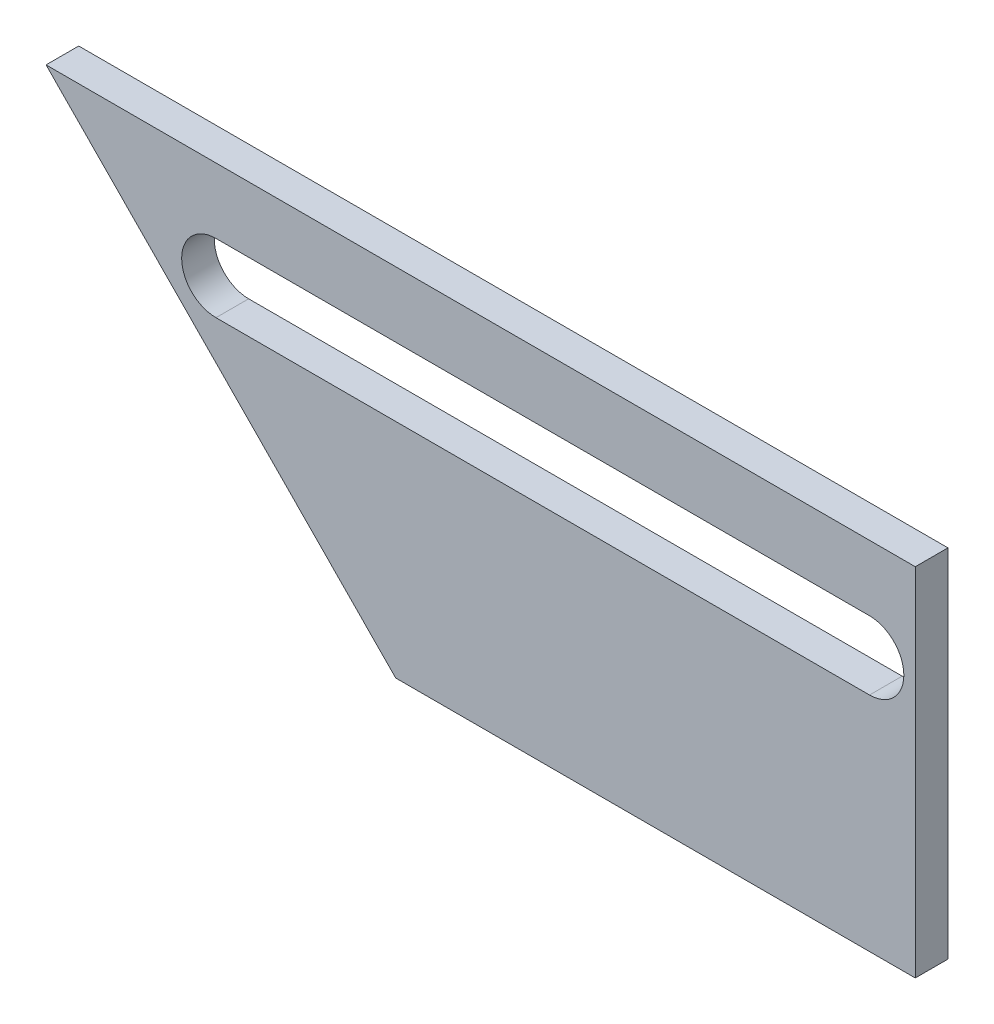
from build123d import *

# Parameters (mm, degrees)
BOSS_EXTRUDE1_DEPTH = 5


with BuildPart() as part:
    # Sketch1 → Boss-Extrude1 (new body)
    with BuildSketch(Plane.XY):
        Polygon((0, 0), (0, 54.5), (-133, 54.5), (-79.5, 0), align=None)
        with BuildLine():
            Line((-107, 44.5), (-7, 44.5))
            ThreePointArc((-7, 44.5), (-1.75, 39.25), (-7, 34))
            Line((-7, 34), (-107, 34))
            ThreePointArc((-107, 34), (-112.25, 39.25), (-107, 44.5))
        make_face(mode=Mode.SUBTRACT)
    extrude(amount=BOSS_EXTRUDE1_DEPTH)


solid = part.part
